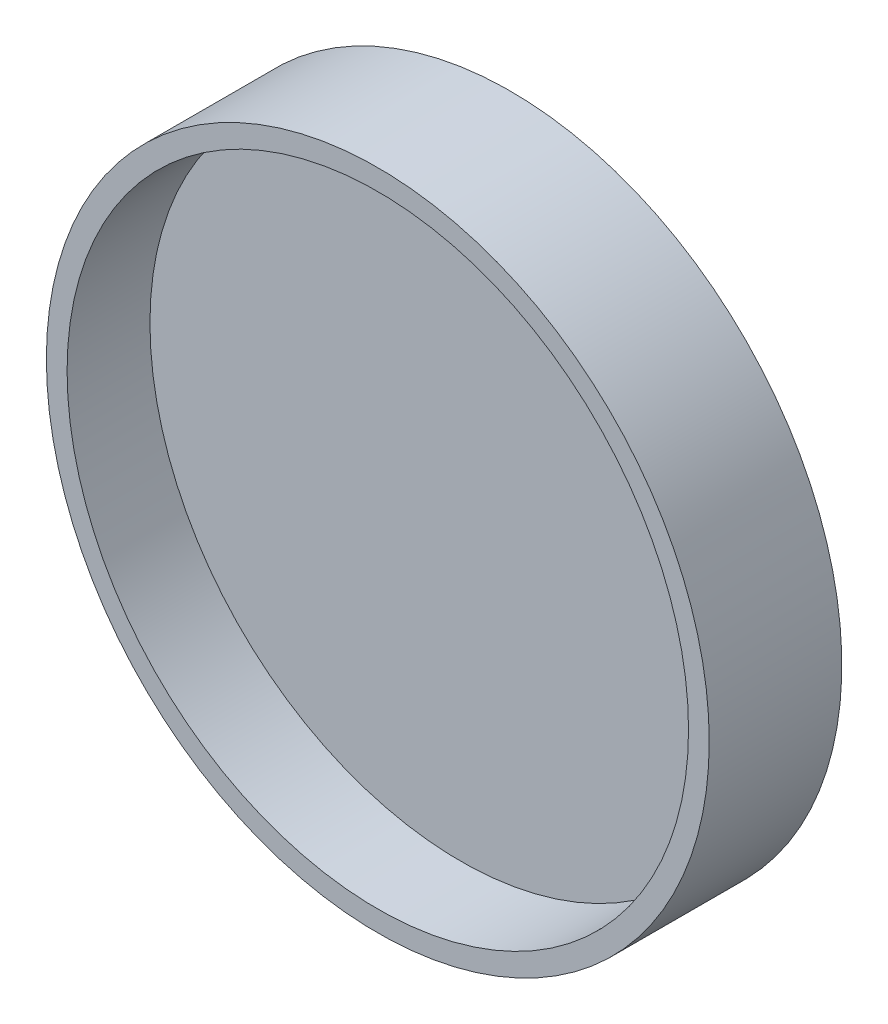
from build123d import *

# Parameters (mm, degrees)
SZKIC1_R                    = 80
DODANIE_WYCI_GNI_CIE1_DEPTH = 30
SZKIC2_R                    = 75
WYTNIJ_WYCI_GNI_CIE2_DEPTH  = 20
DODANIE_WYCI_GNI_CIE2_START = 22
SZKIC20_R                   = 80
DODANIE_WYCI_GNI_CIE2_DEPTH = 22
SZKIC22_R                   = 80
SZKIC22_R_2                 = 34.425
WYTNIJ_WYCI_GNI_CIE3_DEPTH  = 20


with BuildPart() as part:
    # Szkic1 → Dodanie-wyciągnięcie1 (new body)
    with BuildSketch(Plane.XY):
        Circle(SZKIC1_R)
    extrude(amount=DODANIE_WYCI_GNI_CIE1_DEPTH)

    # Szkic2 → Wytnij-wyciągnięcie2 (cut)
    with BuildSketch(Plane.XY.offset(30)):
        Circle(SZKIC2_R)
    extrude(amount=-WYTNIJ_WYCI_GNI_CIE2_DEPTH, mode=Mode.SUBTRACT)

    # Szkic20 → Dodanie-wyciągnięcie2 (add)
    with BuildSketch(Plane(origin=(0, 0, 0), x_dir=(-1, 0, 0), z_dir=(0, 0, -1)).offset(DODANIE_WYCI_GNI_CIE2_START)):
        Circle(SZKIC20_R)
    extrude(amount=-DODANIE_WYCI_GNI_CIE2_DEPTH)

    # Szkic21 → Wycięcie-obrót1 (revolve, cut)
    with BuildSketch(Plane(origin=(0, 0, 0), x_dir=(1, 0, 0), z_dir=(0, 1, 0))):
        Polygon((0, 22), (0, -7.46), (-5, -2.46), (-5, 10.34), (-10.600297611, 20.04), (-13.995117194, 22), align=None)
    revolve(axis=Axis((0, 0, 0), (0, 0, 1)), mode=Mode.SUBTRACT)

    # Szkic22 → Wytnij-wyciągnięcie3 (cut)
    with BuildSketch(Plane(origin=(0, 0, -22), x_dir=(-1, 0, 0), z_dir=(0, 0, -1))):
        Circle(SZKIC22_R)
        Circle(SZKIC22_R_2, mode=Mode.SUBTRACT)
    extrude(amount=-WYTNIJ_WYCI_GNI_CIE3_DEPTH, mode=Mode.SUBTRACT)


solid = part.part
